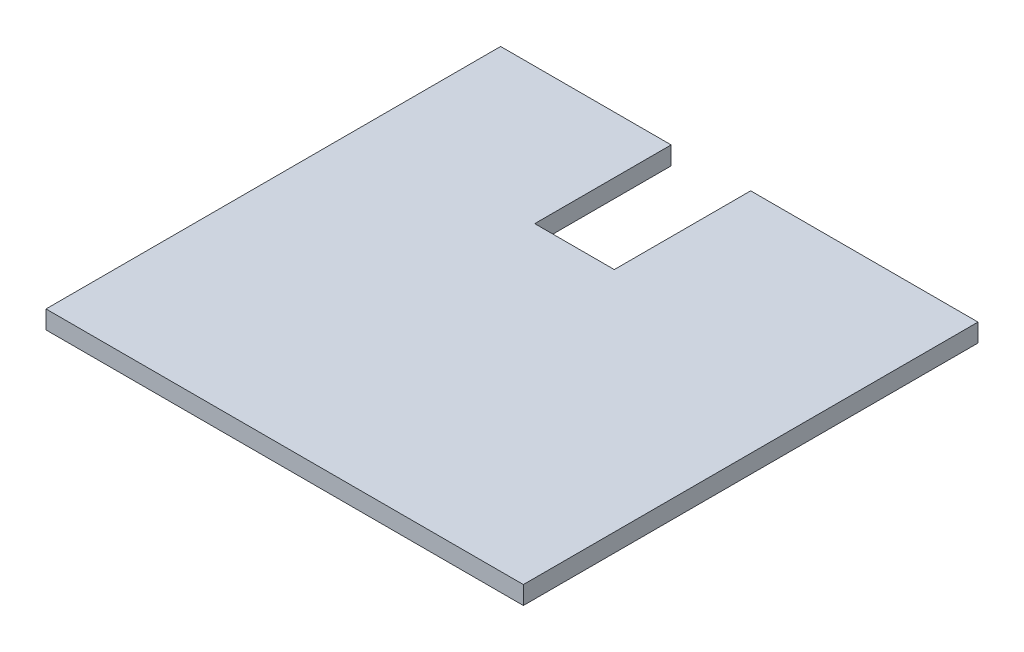
from build123d import *

# Parameters (mm, degrees)
BOSS_EXTRUDE1_DEPTH = 0.8


with BuildPart() as part:
    # Sketch2 → Boss-Extrude1 (new body)
    with BuildSketch(Plane(origin=(0, 0, 0), x_dir=(1, 0, 0), z_dir=(0, 1, 0))):
        Polygon((-9.126213592, 8.300970874), (-1.626213592, 8.300970874), (-1.626213592, 2.300970874), (1.873786408, 2.300970874), (1.873786408, 8.300970874), (11.873786408, 8.300970874), (11.873786408, -11.699029126), (-9.126213592, -11.699029126), align=None)
    extrude(amount=BOSS_EXTRUDE1_DEPTH)


solid = part.part
